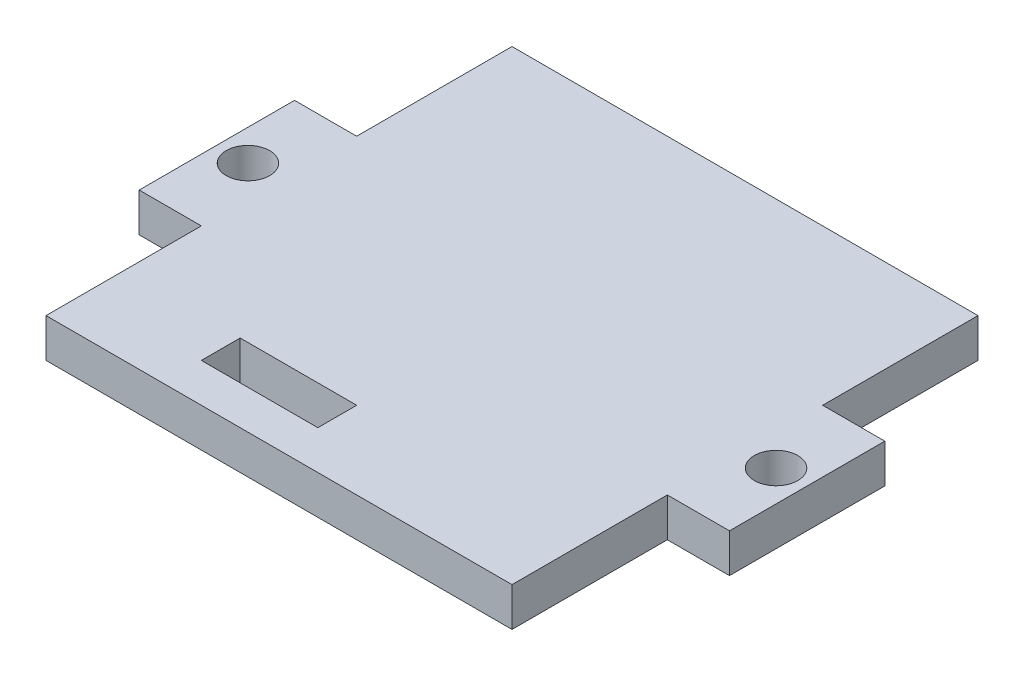
from build123d import *

# Parameters (mm, degrees)
SKETCH1_R           = 1.778
SKETCH1_W           = 9.525
SKETCH1_H           = 3.175
BOSS_EXTRUDE1_DEPTH = 3.175


with BuildPart() as part:
    # Sketch1 → Boss-Extrude1 (new body)
    with BuildSketch(Plane(origin=(0, 0, 0), x_dir=(1, 0, 0), z_dir=(0, 1, 0))):
        Polygon((0, 0), (0, 12.7), (-5.08, 12.7), (-5.08, 25.4), (0, 25.4), (0, 38.1), (38.1, 38.1), (38.1, 25.4), (43.18, 25.4), (43.18, 12.7), (38.1, 12.7), (38.1, 0), align=None)
        with Locations(Location((-2.54, 19.05, 0), (0, 0, 270))):
            Circle(SKETCH1_R, mode=Mode.SUBTRACT)
        with Locations(Location((40.64, 19.05, 0), (0, 0, 270))):
            Circle(SKETCH1_R, mode=Mode.SUBTRACT)
        with Locations((14.2875, 4.7625)):
            Rectangle(SKETCH1_W, SKETCH1_H, mode=Mode.SUBTRACT)
    extrude(amount=BOSS_EXTRUDE1_DEPTH)


solid = part.part
